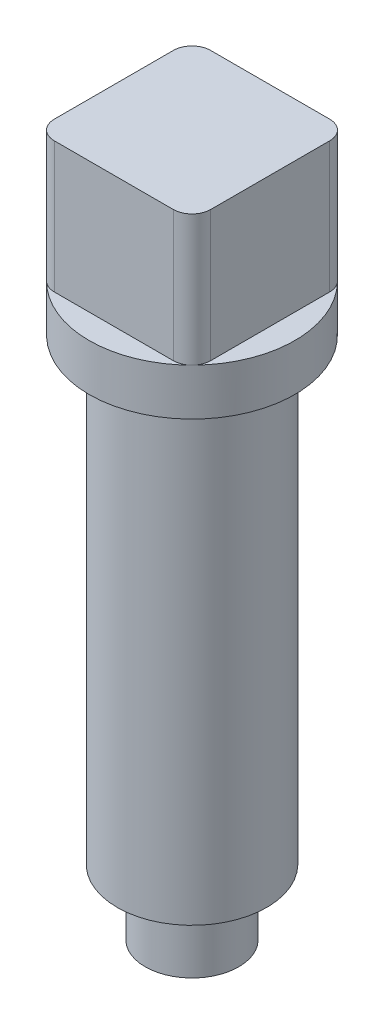
from build123d import *

# Parameters (mm, degrees)
BOSS_EXTRUDE2_DEPTH = 14


with BuildPart() as part:
    # Sketch1 → Revolve1 (revolve)
    with BuildSketch(Plane.XY, mode=Mode.PRIVATE) as revolve1_sk:
        Polygon((0, 0), (5, 0), (5, 7), (8, 7), (8, 56), (11, 56), (11, 61), (0, 61), align=None)
    revolve(revolve1_sk.sketch.rotate(Axis((0, 61, 0), (0, -1, 0)), 90), axis=Axis((0, 61, 0), (0, -1, 0)))

    # Sketch2 → Boss-Extrude2 (add)
    with BuildSketch(Plane(origin=(0, 61, 0), x_dir=(1, 0, 0), z_dir=(0, 1, 0))):
        with BuildLine():
            Line((-6.363961031, 8.363961031), (6.363961031, 8.363961031))
            ThreePointArc((6.363961031, 8.363961031), (7.778174593, 7.778174593), (8.363961031, 6.363961031))
            Line((8.363961031, 6.363961031), (8.363961031, -6.363961031))
            ThreePointArc((8.363961031, -6.363961031), (7.778174593, -7.778174593), (6.363961031, -8.363961031))
            Line((6.363961031, -8.363961031), (-6.363961031, -8.363961031))
            ThreePointArc((-6.363961031, -8.363961031), (-7.778174593, -7.778174593), (-8.363961031, -6.363961031))
            Line((-8.363961031, -6.363961031), (-8.363961031, 6.363961031))
            ThreePointArc((-8.363961031, 6.363961031), (-7.778174593, 7.778174593), (-6.363961031, 8.363961031))
        make_face()
    extrude(amount=BOSS_EXTRUDE2_DEPTH)


solid = part.part
